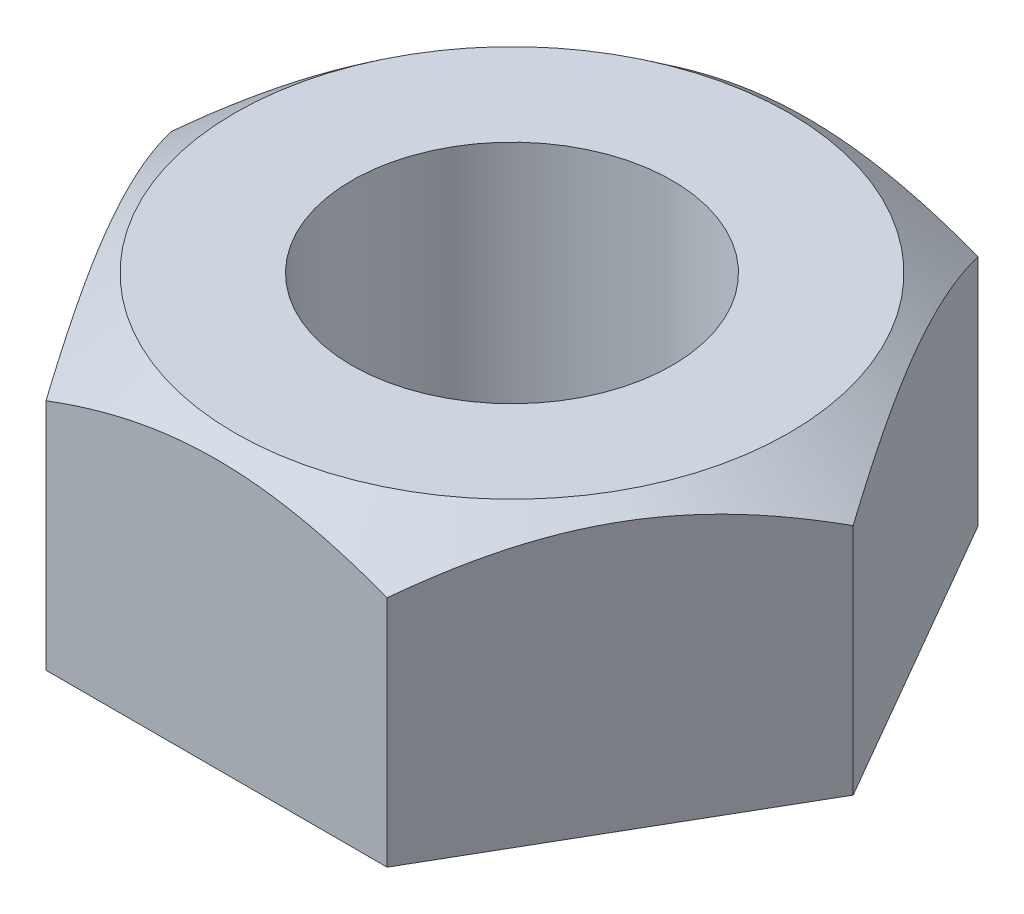
from build123d import *

# Parameters (mm, degrees)
SKETCH1_R           = 2.15
BOSS_EXTRUDE1_DEPTH = 3.78


with BuildPart() as part:
    # Sketch1 → Boss-Extrude1 (new body)
    with BuildSketch(Plane(origin=(0, 0, 0), x_dir=(1, 0, 0), z_dir=(0, 1, 0))):
        Polygon((4.578387635, 0), (2.289193817, 3.965), (-2.289193817, 3.965), (-4.578387635, 0), (-2.289193817, -3.965), (2.289193817, -3.965), align=None)
        with Locations(Location((0, 0, 0), (0, 0, 270))):
            Circle(SKETCH1_R, mode=Mode.SUBTRACT)
    extrude(amount=BOSS_EXTRUDE1_DEPTH)

    # Sketch2 → Cut-Revolve1 (revolve, cut)
    with BuildSketch(Plane(origin=(0, 0, 0), x_dir=(0, 0, -1), z_dir=(1, 0, 0)), mode=Mode.PRIVATE) as cut_revolve1_sk:
        Polygon((3.008379415, 4.316956257), (7.760790511, 0.730297909), (8.861229965, 2.9800107), align=None)
    revolve(cut_revolve1_sk.sketch.rotate(Axis((0, 0, 0), (0, 1, 0)), 329.999999889), axis=Axis((0, 0, 0), (0, 1, 0)), mode=Mode.SUBTRACT)


solid = part.part
